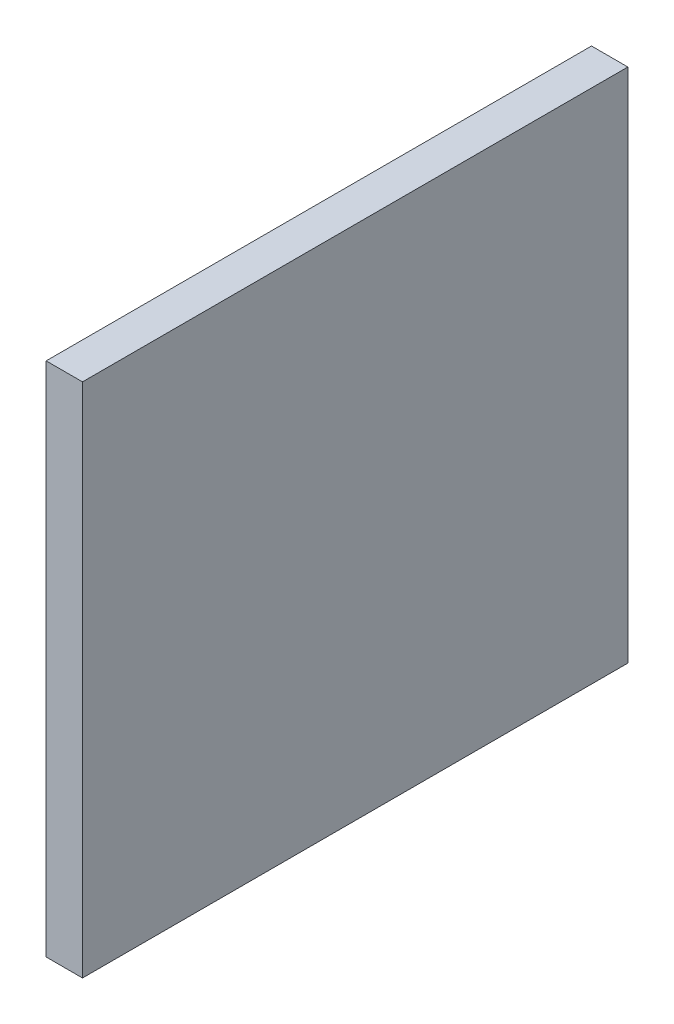
from build123d import *

# Parameters (mm, degrees)
CROQUIS1_W              = 75
CROQUIS1_H              = 71
SALIENTE_EXTRUIR1_DEPTH = 5


with BuildPart() as part:
    # Croquis1 → Saliente-Extruir1 (new body)
    with BuildSketch(Plane(origin=(0, 0, 0), x_dir=(0, 0, -1), z_dir=(1, 0, 0))):
        with Locations((-52.959259259, 13.674074074)):
            Rectangle(CROQUIS1_W, CROQUIS1_H)
    extrude(amount=SALIENTE_EXTRUIR1_DEPTH)


solid = part.part
